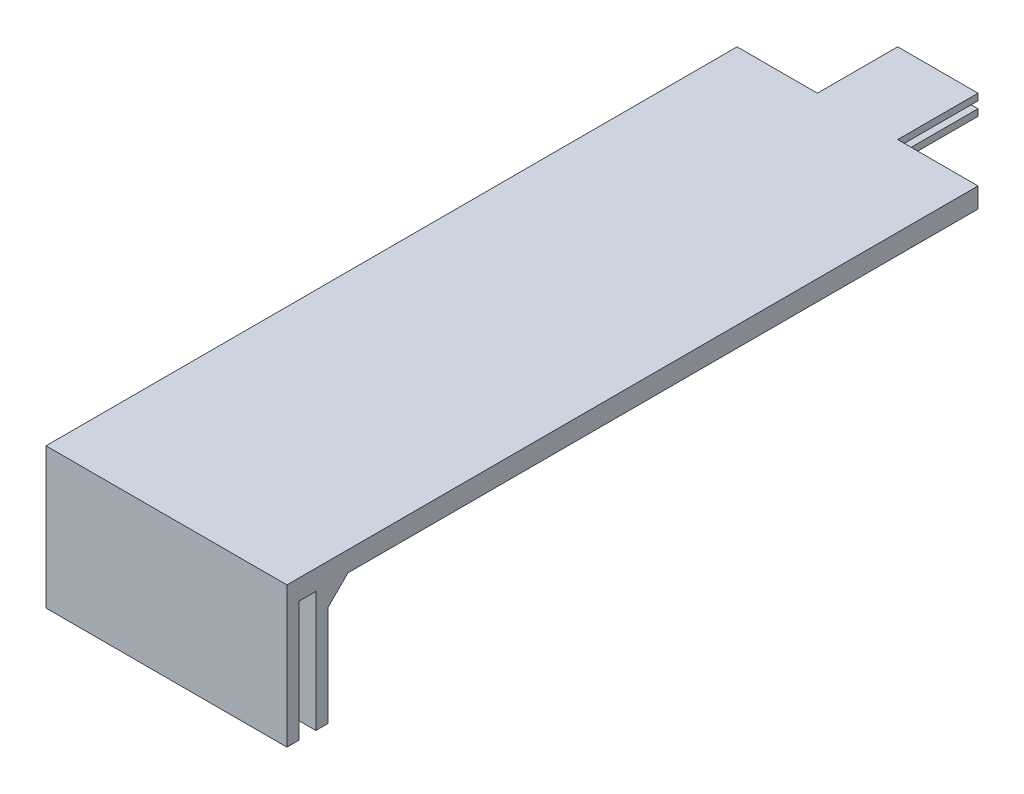
from build123d import *

# Parameters (mm, degrees)
SKETCH1_W                = 20
SKETCH1_H                = 80
BOSS_EXTRUDE1_DEPTH      = 5
BOSS_EXTRUDE2_DEPTH      = 30
BOSS_EXTRUDE2_DEPTH_BACK = 5
SKETCH2_W                = 20
SKETCH2_H                = 10.2
SKETCH3_W                = 20
SKETCH3_H                = 4.2
CUT_EXTRUDE1_DEPTH       = 30
BOSS_EXTRUDE3_DEPTH      = 40
SKETCH6_W                = 60
SKETCH6_H                = 5
BOSS_EXTRUDE4_DEPTH      = 81.9
SKETCH7_W                = 20
SKETCH7_H                = 1.65
BOSS_EXTRUDE5_DEPTH      = 20
CHAMFER1_SIZE            = 5


with BuildPart() as part:
    # Sketch1 → Boss-Extrude1 (new body)
    with BuildSketch(Plane(origin=(0, 0, 0), x_dir=(1, 0, 0), z_dir=(0, 1, 0))):
        with Locations((10, 40)):
            Rectangle(SKETCH1_W, SKETCH1_H)
    extrude(amount=BOSS_EXTRUDE1_DEPTH)

    # Sketch2 → Boss-Extrude2 (add, two sides: drawn at the far end of the back side and taken through both)
    with BuildSketch(Plane.XZ.offset(-BOSS_EXTRUDE2_DEPTH_BACK)):
        with Locations((10, 5.1)):
            Rectangle(SKETCH2_W, SKETCH2_H)
    extrude(amount=BOSS_EXTRUDE2_DEPTH + BOSS_EXTRUDE2_DEPTH_BACK)

    # Sketch3 → Cut-Extrude1 (cut)
    with BuildSketch(Plane.XZ.offset(30)):
        with Locations((10, 5.1)):
            Rectangle(SKETCH3_W, SKETCH3_H)
    extrude(amount=-CUT_EXTRUDE1_DEPTH, mode=Mode.SUBTRACT)

    # Sketch5 → Boss-Extrude3 (add)
    with BuildSketch(Plane.ZY):
        Polygon((3, 0), (7.2, 0), (7.2, 5), (-80, 5), (-80, 0), (0, 0), (0, -30), (3, -30), align=None)
        Polygon((7.2, -30), (10.2, -30), (10.2, 5), (7.2, 5), (7.2, 0), align=None)
    extrude(amount=BOSS_EXTRUDE3_DEPTH)

    # Sketch6 → Boss-Extrude4 (add)
    with BuildSketch(Plane(origin=(0, 0, -80), x_dir=(-1, 0, 0), z_dir=(0, 0, -1))):
        with Locations((10, 2.5)):
            Rectangle(SKETCH6_W, SKETCH6_H)
    extrude(amount=BOSS_EXTRUDE4_DEPTH)

    # Sketch7 → Boss-Extrude5 (add)
    with BuildSketch(Plane(origin=(0, 0, -161.9), x_dir=(-1, 0, 0), z_dir=(0, 0, -1))):
        with Locations((10, 4.175)):
            Rectangle(SKETCH7_W, SKETCH7_H)
        with Locations((10, 0.825)):
            Rectangle(SKETCH7_W, SKETCH7_H)
    extrude(amount=BOSS_EXTRUDE5_DEPTH)

    # Chamfer1
    chamfer1_edges = [part.edges().sort_by_distance(p)[0] for p in [
        (-10, 0, 0),
    ]]
    chamfer(chamfer1_edges, length=CHAMFER1_SIZE)


solid = part.part
